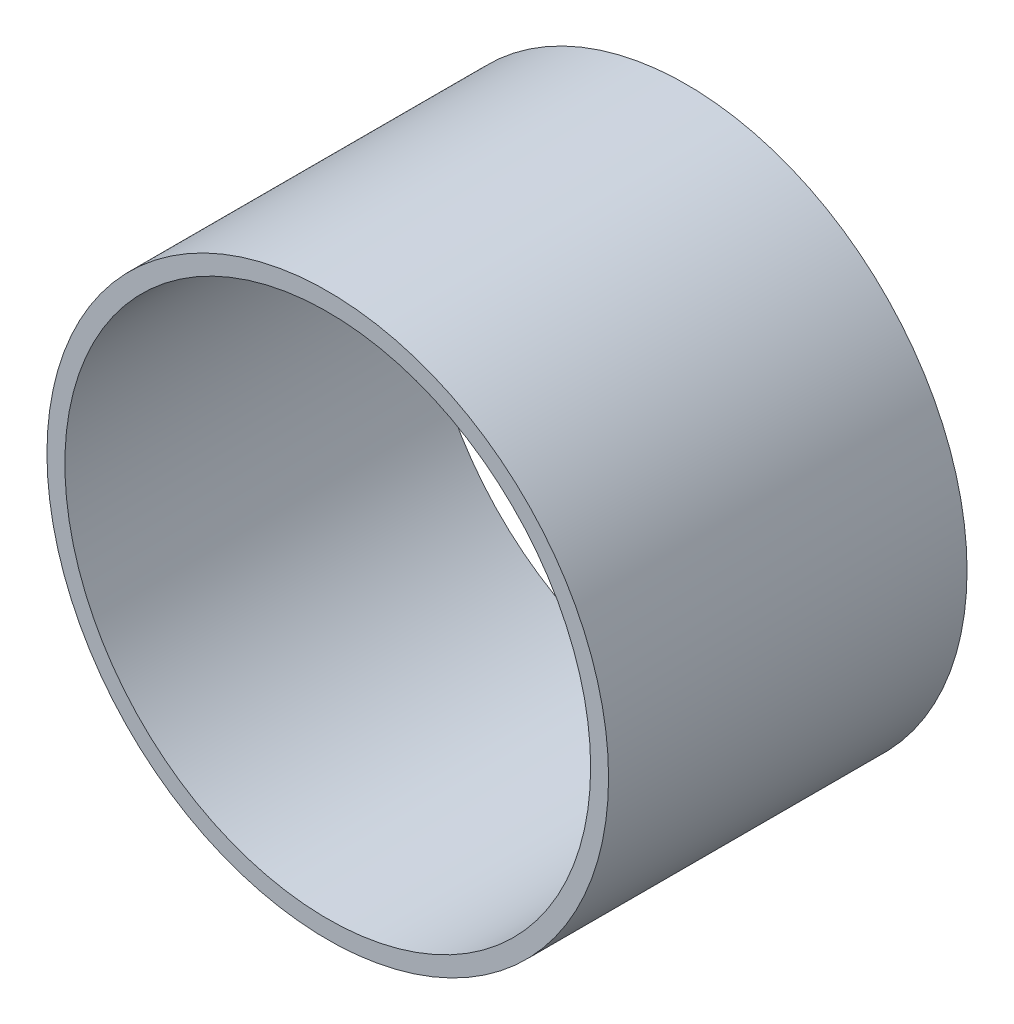
from build123d import *

# Parameters (mm, degrees)
SKETCH2_R           = 596.9
BOSS_EXTRUDE1_DEPTH = 762
SKETCH3_R           = 558.8
CUT_EXTRUDE1_DEPTH  = 762


with BuildPart() as part:
    # Sketch2 → Boss-Extrude1 (new body)
    with BuildSketch(Plane.XY):
        Circle(SKETCH2_R)
    extrude(amount=BOSS_EXTRUDE1_DEPTH)

    # Sketch3 → Cut-Extrude1 (cut)
    with BuildSketch(Plane.XY.offset(762)):
        Circle(SKETCH3_R)
    extrude(amount=-CUT_EXTRUDE1_DEPTH, mode=Mode.SUBTRACT)


solid = part.part
